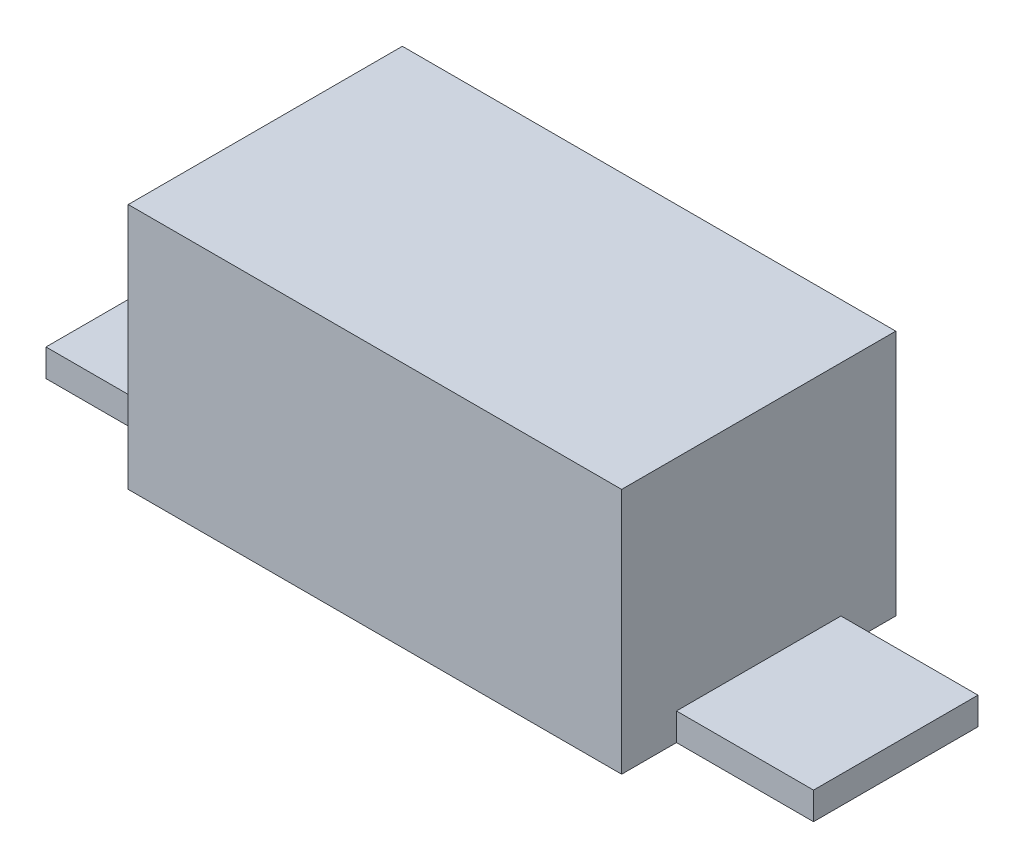
from build123d import *

# Parameters (mm, degrees)
SCHIZZO1_W                   = 1.8
SCHIZZO1_H                   = 1
ESTRUSIONE_ESTRUSIONE1_DEPTH = 0.9
SCHIZZO2_W                   = 0.6
SCHIZZO2_H                   = 0.1
ESTRUSIONE_ESTRUSIONE2_DEPTH = 0.5
SCHIZZO3_W                   = 0.6
SCHIZZO3_H                   = 0.1
ESTRUSIONE_ESTRUSIONE3_DEPTH = 0.5


with BuildPart() as part:
    # Schizzo1 → Estrusione-Estrusione1 (new body)
    with BuildSketch(Plane(origin=(0, 0, 0), x_dir=(1, 0, 0), z_dir=(0, 1, 0))):
        with Locations((-14.621048093, 8.260524047)):
            Rectangle(SCHIZZO1_W, SCHIZZO1_H)
    extrude(amount=ESTRUSIONE_ESTRUSIONE1_DEPTH)

    # Schizzo2 → Estrusione-Estrusione2 (add)
    with BuildSketch(Plane.ZY.offset(15.521048093)):
        with Locations((-8.260524047, 0.05)):
            Rectangle(SCHIZZO2_W, SCHIZZO2_H)
    extrude(amount=ESTRUSIONE_ESTRUSIONE2_DEPTH)

    # Schizzo3 → Estrusione-Estrusione3 (add)
    with BuildSketch(Plane(origin=(-13.721048093, 0, 0), x_dir=(0, 0, -1), z_dir=(1, 0, 0))):
        with Locations((8.260524047, 0.05)):
            Rectangle(SCHIZZO3_W, SCHIZZO3_H)
    extrude(amount=ESTRUSIONE_ESTRUSIONE3_DEPTH)


solid = part.part
